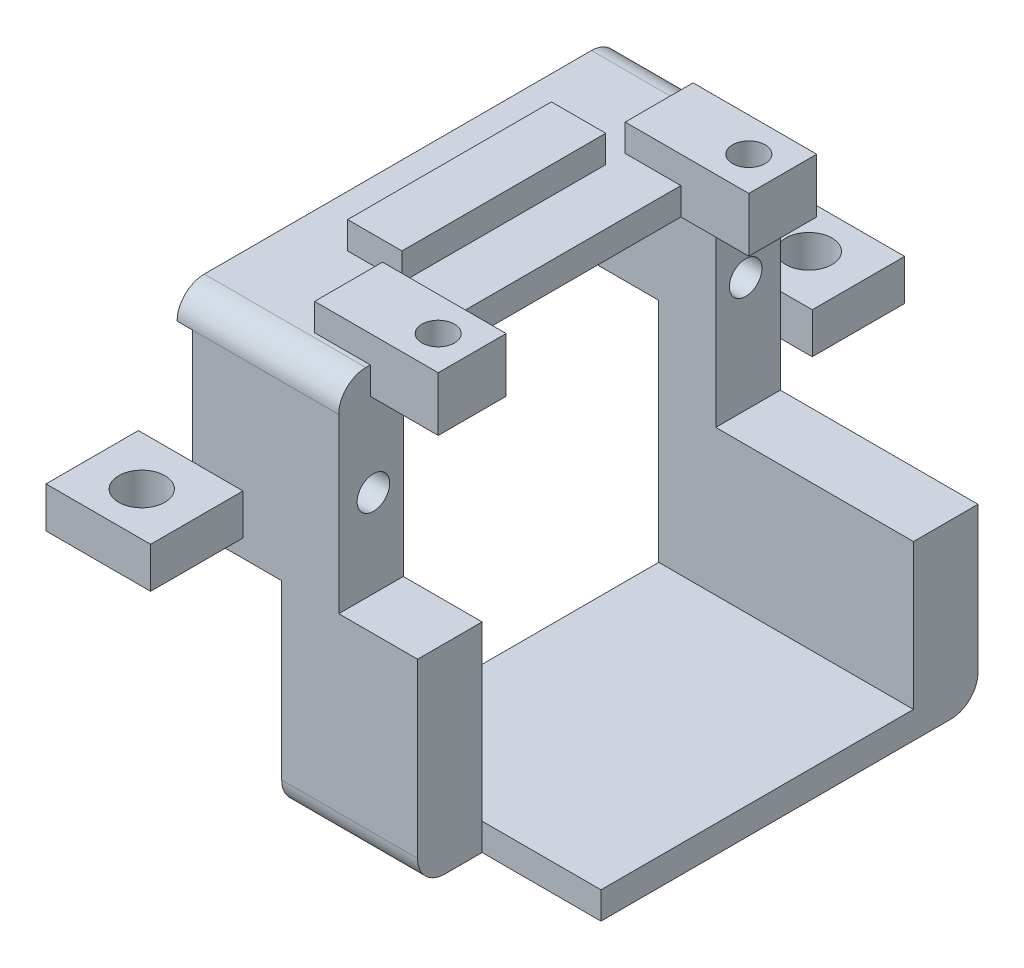
from build123d import *

# Parameters (mm, degrees)
BOSS_EXTRUDE1_DEPTH      = 2
SKETCH1_3_W              = 10
SKETCH1_3_H              = 4.75
BOSS_EXTRUDE2_DEPTH      = 12.7
BOSS_EXTRUDE3_START      = 12.7
SKETCH3_W                = 11.9
SKETCH3_H                = 4.75
SKETCH3_W_2              = 10.75
BOSS_EXTRUDE3_DEPTH      = 12.7
BOSS_EXTRUDE4_START      = 25.4
SKETCH3_3_W              = 11.9
SKETCH3_3_H              = 4.75
SKETCH3_3_W_2            = 10.75
SKETCH3_3_W_3            = 1.15
BOSS_EXTRUDE4_DEPTH      = 2
CUT_EXTRUDE1_START       = -1.1
SKETCH2_R                = 1.2
CUT_EXTRUDE1_DEPTH       = 8
CUT_EXTRUDE2_START       = 3.1
SKETCH2_3_R              = 1.2
CUT_EXTRUDE2_DEPTH       = 8
BOSS_EXTRUDE5_START      = 17
SKETCH1_4_W              = 7.7
SKETCH1_4_H              = 6.8
SKETCH1_4_R              = 1.7
BOSS_EXTRUDE5_DEPTH      = 3
FILLET1_R                = 2
CUT_EXTRUDE3_START       = 12.7
SKETCH5_W                = 14.55
SKETCH5_H                = 4.75
CUT_EXTRUDE3_DEPTH       = 2
CUT_EXTRUDE4_START       = 12.7
SKETCH6_W                = 7.7
SKETCH6_H                = 4.75
CUT_EXTRUDE4_DEPTH       = 4
BOSS_EXTRUDE6_DEPTH      = 2
BOSS_EXTRUDE6_DEPTH_BACK = 2
BOSS_EXTRUDE6_START      = 27.4
SKETCH7_W                = 9.1
SKETCH7_H                = 5
SKETCH7_R                = 1.2
SKETCH7_W_2              = 4
SKETCH7_H_2              = 15


with BuildPart() as part:
    # Sketch1 → Boss-Extrude1 (new body)
    with BuildSketch(Plane(origin=(0, 0, 0), x_dir=(1, 0, 0), z_dir=(0, 1, 0))):
        Polygon((-1.1, 16.25), (-1.1, -16.25), (8.9, -16.25), (8.9, -11.5), (17.65, -11.5), (17.65, 16.25), align=None)
    extrude(amount=-BOSS_EXTRUDE1_DEPTH)

    # Sketch1<3> → Boss-Extrude2 (add)
    with BuildSketch(Plane(origin=(0, 0, 0), x_dir=(1, 0, 0), z_dir=(0, 1, 0))):
        Polygon((5.45, 16.25), (-1.1, 16.25), (-1.1, 11.5), (17.65, 11.5), (17.65, 16.25), align=None)
        with Locations((3.9, -13.875)):
            Rectangle(SKETCH1_3_W, SKETCH1_3_H)
    extrude(amount=BOSS_EXTRUDE2_DEPTH)

    # Sketch3 → Boss-Extrude3 (add)
    with BuildSketch(Plane(origin=(0, 0, 0), x_dir=(1, 0, 0), z_dir=(0, 1, 0)).offset(BOSS_EXTRUDE3_START)):
        with Locations((-2.85, 13.875)):
            Rectangle(SKETCH3_W, SKETCH3_H)
        with Locations((-2.275, -13.875)):
            Rectangle(SKETCH3_W_2, SKETCH3_H)
    extrude(amount=BOSS_EXTRUDE3_DEPTH)

    # Sketch3<3> → Boss-Extrude4 (add)
    with BuildSketch(Plane(origin=(0, 0, 0), x_dir=(1, 0, 0), z_dir=(0, 1, 0)).offset(BOSS_EXTRUDE4_START)):
        with Locations((-2.85, 13.875)):
            Rectangle(SKETCH3_3_W, SKETCH3_3_H)
        Polygon((3.1, -11.5), (3.1, 11.5), (-8.8, 11.5), (-8.8, -11.5), (-7.65, -11.5), align=None)
        with Locations((-2.275, -13.875)):
            Rectangle(SKETCH3_3_W_2, SKETCH3_3_H)
        with Locations((-8.225, -13.875)):
            Rectangle(SKETCH3_3_W_3, SKETCH3_3_H)
    extrude(amount=BOSS_EXTRUDE4_DEPTH)

    # Sketch2 → Cut-Extrude1 (cut)
    with BuildSketch(Plane(origin=(0, 0, 0), x_dir=(0, 0, -1), z_dir=(1, 0, 0)).offset(CUT_EXTRUDE1_START)):
        with Locations(Location((-13.7, 6.45, 0), (0, 0, 180))):
            Circle(SKETCH2_R)
        with Locations(Location((13.7, 6.45, 0), (0, 0, 180))):
            Circle(SKETCH2_R)
    extrude(amount=CUT_EXTRUDE1_DEPTH, mode=Mode.SUBTRACT)

    # Sketch2<3> → Cut-Extrude2 (cut)
    with BuildSketch(Plane(origin=(0, 0, 0), x_dir=(0, 0, -1), z_dir=(1, 0, 0)).offset(CUT_EXTRUDE2_START)):
        with Locations(Location((13.7, 19.15, 0), (0, 0, 180))):
            Circle(SKETCH2_3_R)
        with Locations(Location((-13.7, 19.15, 0), (0, 0, 180))):
            Circle(SKETCH2_3_R)
    extrude(amount=-CUT_EXTRUDE2_DEPTH, mode=Mode.SUBTRACT)

    # Sketch1<4> → Boss-Extrude5 (add)
    # profile 1 of 2: a face of its own
    with BuildSketch(Plane(origin=(0, 0, 0), x_dir=(1, 0, 0), z_dir=(0, 1, 0)).offset(BOSS_EXTRUDE5_START)):
        with Locations((1.6, 19.65)):
            Rectangle(SKETCH1_4_W, SKETCH1_4_H)
        with Locations(Location((1.6, 19.85, 0), (0, 0, 270))):
            Circle(SKETCH1_4_R, mode=Mode.SUBTRACT)
    # profile 2 of 2: a face of its own
    with BuildSketch(Plane(origin=(0, 0, 0), x_dir=(1, 0, 0), z_dir=(0, 1, 0)).offset(BOSS_EXTRUDE5_START)):
        with Locations((-7.8, -19.65)):
            Rectangle(SKETCH1_4_W, SKETCH1_4_H)
        with Locations(Location((-7.8, -19.85, 0), (0, 0, 270))):
            Circle(SKETCH1_4_R, mode=Mode.SUBTRACT)
    extrude(amount=-BOSS_EXTRUDE5_DEPTH)

    # Fillet1
    fillet1_edges = [part.edges().sort_by_distance(p)[0] for p in [
        (3.9, -2, 16.25),
        (-2.85, 27.4, 16.25),
        (8.275, -2, -16.25),
        (-2.85, 27.4, -16.25),
    ]]
    fillet(fillet1_edges, radius=FILLET1_R)

    # Sketch5 → Cut-Extrude3 (cut)
    with BuildSketch(Plane(origin=(0, 0, 0), x_dir=(1, 0, 0), z_dir=(0, 1, 0)).offset(CUT_EXTRUDE3_START)):
        with Locations((10.375, 13.875)):
            Rectangle(SKETCH5_W, SKETCH5_H)
    extrude(amount=-CUT_EXTRUDE3_DEPTH, mode=Mode.SUBTRACT)

    # Sketch6 → Cut-Extrude4 (cut)
    with BuildSketch(Plane(origin=(0, 0, 0), x_dir=(1, 0, 0), z_dir=(0, 1, 0)).offset(CUT_EXTRUDE4_START)):
        with Locations((-4.95, 13.875)):
            Rectangle(SKETCH6_W, SKETCH6_H)
    extrude(amount=CUT_EXTRUDE4_DEPTH, mode=Mode.SUBTRACT)

    # Sketch7 → Boss-Extrude6 (add, two sides: drawn at the far end of the back side and taken through both)
    # profile 1 of 3: a face of its own
    with BuildSketch(Plane(origin=(0, 0, 0), x_dir=(1, 0, 0), z_dir=(0, 1, 0)).offset(BOSS_EXTRUDE6_START - BOSS_EXTRUDE6_DEPTH_BACK)):
        with Locations((3.55, 11.43)):
            Rectangle(SKETCH7_W, SKETCH7_H)
        with Locations(Location((5.6, 11.43, 0), (0, 0, 90))):
            Circle(SKETCH7_R, mode=Mode.SUBTRACT)
    # profile 2 of 3: a face of its own
    with BuildSketch(Plane(origin=(0, 0, 0), x_dir=(1, 0, 0), z_dir=(0, 1, 0)).offset(BOSS_EXTRUDE6_START - BOSS_EXTRUDE6_DEPTH_BACK)):
        with Locations((-3, 0)):
            Rectangle(SKETCH7_W_2, SKETCH7_H_2)
    # profile 3 of 3: a face of its own
    with BuildSketch(Plane(origin=(0, 0, 0), x_dir=(1, 0, 0), z_dir=(0, 1, 0)).offset(BOSS_EXTRUDE6_START - BOSS_EXTRUDE6_DEPTH_BACK)):
        with Locations((3.55, -11.43)):
            Rectangle(SKETCH7_W, SKETCH7_H)
        with Locations(Location((5.6, -11.43, 0), (0, 0, 90))):
            Circle(SKETCH7_R, mode=Mode.SUBTRACT)
    extrude(amount=BOSS_EXTRUDE6_DEPTH + BOSS_EXTRUDE6_DEPTH_BACK)


solid = part.part
